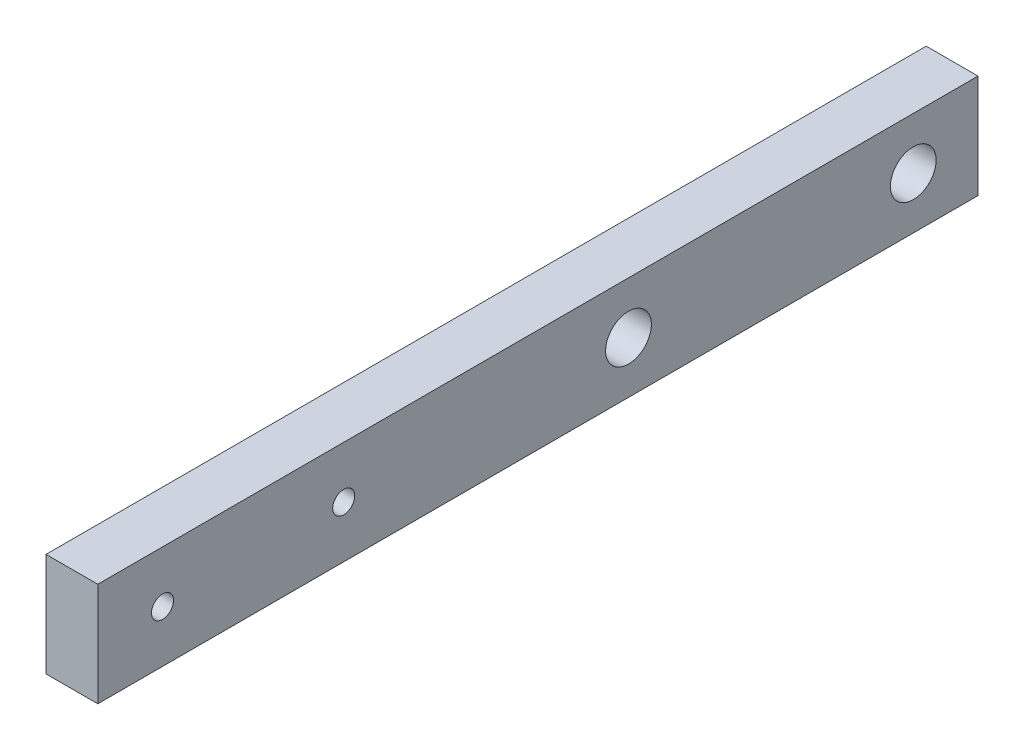
from build123d import *

# Parameters (mm, degrees)
SKETCH1_W              = 6.35
SKETCH1_H              = 12.7
EXTRUDE1_DEPTH         = 107.95
F_10_CLEARANCE_HOLE1_D = 5.6134
F_6_32_TAPPED_HOLE1_D  = 2.7051


with BuildPart() as part:
    # Sketch1 → Extrude1 (new body)
    with BuildSketch(Plane.XY):
        with Locations((3.175, 6.35)):
            Rectangle(SKETCH1_W, SKETCH1_H)
    extrude(amount=EXTRUDE1_DEPTH)

    # #10 Clearance Hole1 (through all)
    with Locations(Plane(origin=(6.35, 0, 0), x_dir=(0, 0, -1), z_dir=(1, 0, 0))):
        with Locations((-42.8625, 6.35), (-7.9375, 6.35)):
            Hole(F_10_CLEARANCE_HOLE1_D / 2)

    # #6-32 Tapped Hole1 (through all)
    with Locations(Plane.ZY):
        with Locations((100.0125, 6.35), (77.7875, 6.35)):
            Hole(F_6_32_TAPPED_HOLE1_D / 2)


solid = part.part
